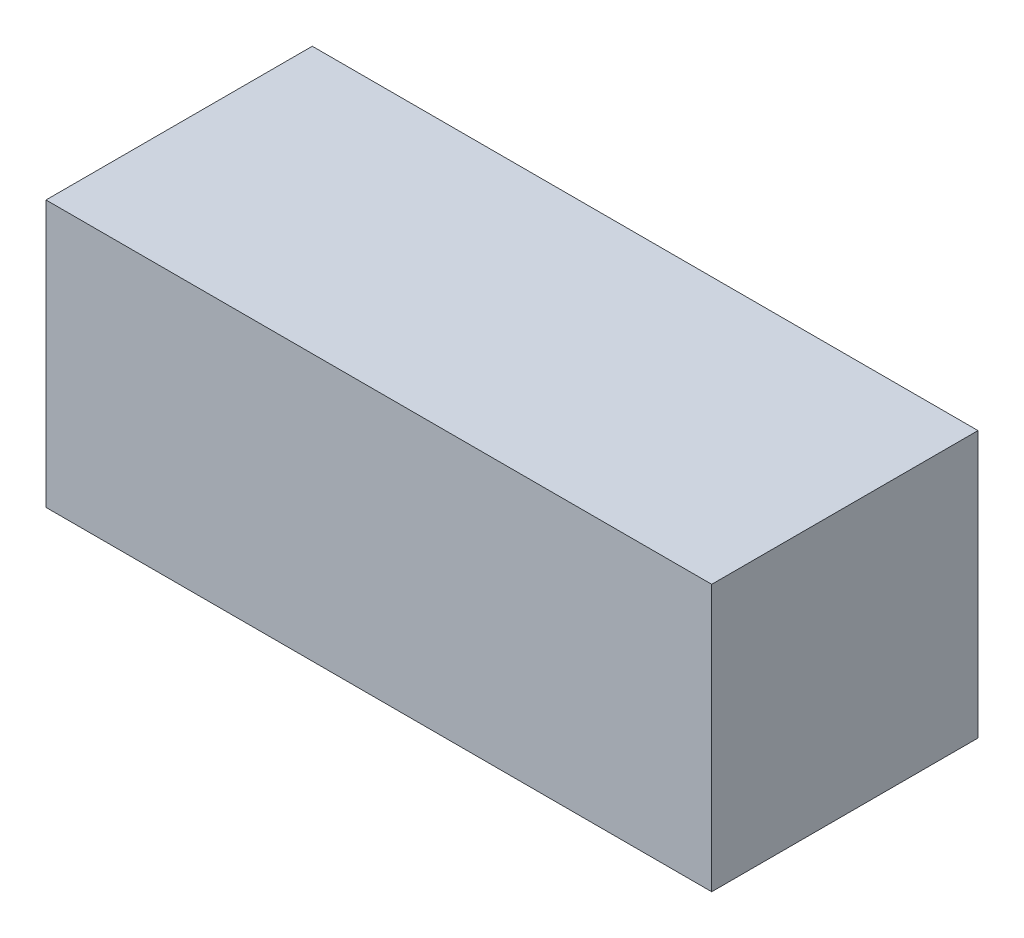
from build123d import *

# Parameters (mm, degrees)
SKETCH1_W           = 38.1
SKETCH1_H           = 38.1
BOSS_EXTRUDE1_DEPTH = 47.625


with BuildPart() as part:
    # Sketch1 → Boss-Extrude1 (new, symmetric)
    with BuildSketch(Plane(origin=(0, 0, 0), x_dir=(0, 0, -1), z_dir=(1, 0, 0))):
        Rectangle(SKETCH1_W, SKETCH1_H)
    extrude(amount=BOSS_EXTRUDE1_DEPTH, both=True)


solid = part.part
